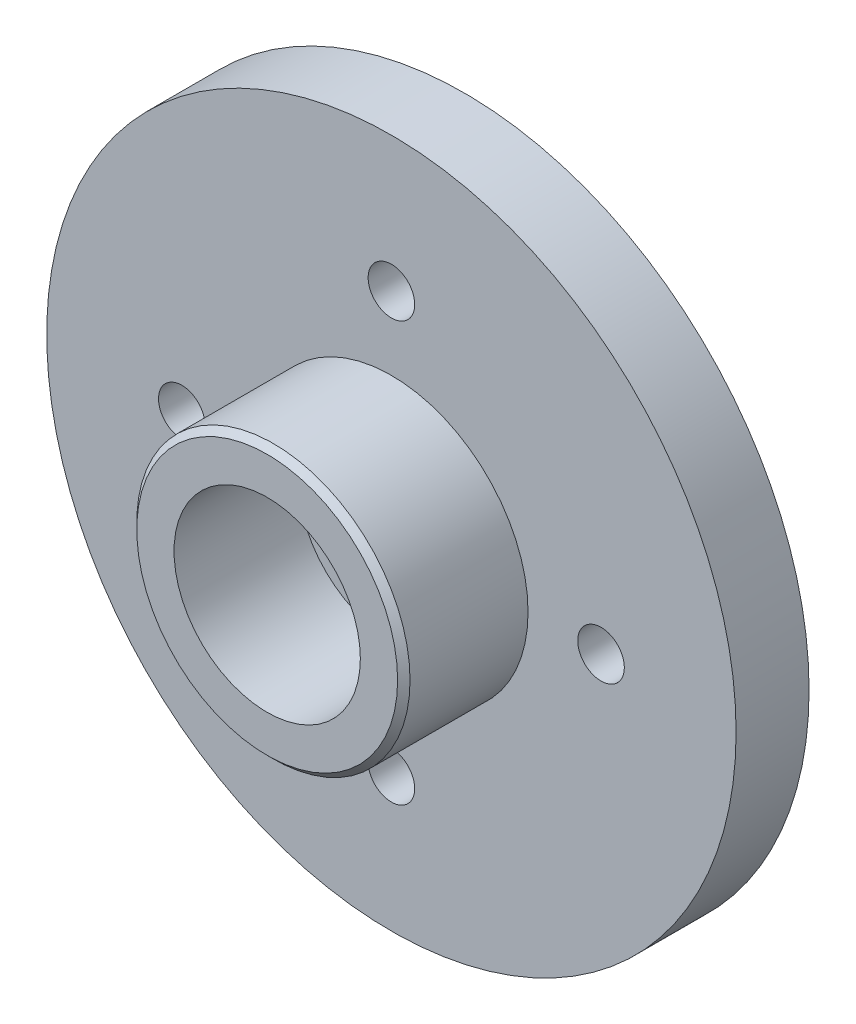
from build123d import *

# Parameters (mm, degrees)
ESQUISSE1_R             = 11.1
ESQUISSE1_R_2           = 1.5
BOSS_EXTRU_1_DEPTH      = 2.35
ESQUISSE2_R             = 4.4
ESQUISSE2_R_2           = 3
BOSS_EXTRU_2_DEPTH      = 4
ESQUISSE3_R             = 1.43
ENL_V_MAT_EXTRU_1_DEPTH = 4
CHANFREIN2_SIZE         = 0.2
ESQUISSE4_R             = 1.5
ENL_V_MAT_EXTRU_2_DEPTH = 4
BOSS_EXTRU_3_START      = -2.35
ESQUISSE5_R             = 1.5
ESQUISSE5_R_2           = 0.75
BOSS_EXTRU_3_DEPTH      = 2.35


with BuildPart() as part:
    # Esquisse1 → Boss.-Extru.1 (new body)
    with BuildSketch(Plane.XY):
        Circle(ESQUISSE1_R)
        with Locations((0, 6.75)):
            Circle(ESQUISSE1_R_2, mode=Mode.SUBTRACT)
        with Locations((0, -6.75)):
            Circle(ESQUISSE1_R_2, mode=Mode.SUBTRACT)
    extrude(amount=BOSS_EXTRU_1_DEPTH)

    # Esquisse2 → Boss.-Extru.2 (add)
    with BuildSketch(Plane.XY.offset(2.35)):
        Circle(ESQUISSE2_R)
        Circle(ESQUISSE2_R_2, mode=Mode.SUBTRACT)
    extrude(amount=BOSS_EXTRU_2_DEPTH)

    # Esquisse3 → Enlèv. mat.-Extru.1 (cut)
    with BuildSketch(Plane.XY.offset(2.35)):
        Circle(ESQUISSE3_R)
    extrude(amount=-ENL_V_MAT_EXTRU_1_DEPTH, mode=Mode.SUBTRACT)

    # Chanfrein2
    chanfrein2_edges = [part.edges().sort_by_distance(p)[0] for p in [
        (-4.4, 0, 6.35),
    ]]
    chamfer(chanfrein2_edges, length=CHANFREIN2_SIZE)

    # Esquisse4 → Enlèv. mat.-Extru.2 (cut)
    with BuildSketch(Plane(origin=(0, 0, 0), x_dir=(-1, 0, 0), z_dir=(0, 0, -1))):
        with Locations((-6.75, 0)):
            Circle(ESQUISSE4_R)
        with Locations((6.75, 0)):
            Circle(ESQUISSE4_R)
    extrude(amount=-ENL_V_MAT_EXTRU_2_DEPTH, mode=Mode.SUBTRACT)

    # Esquisse5 → Boss.-Extru.3 (add)
    # profile 1 of 4: a face of its own
    with BuildSketch(Plane.XY.offset(2.35).offset(BOSS_EXTRU_3_START)):
        with Locations((-6.75, 0)):
            Circle(ESQUISSE5_R)
        with Locations((-6.75, 0)):
            Circle(ESQUISSE5_R_2, mode=Mode.SUBTRACT)
    # profile 2 of 4: a face of its own
    with BuildSketch(Plane.XY.offset(2.35).offset(BOSS_EXTRU_3_START)):
        with Locations((0, -6.75)):
            Circle(ESQUISSE5_R)
        with Locations((0, -6.75)):
            Circle(ESQUISSE5_R_2, mode=Mode.SUBTRACT)
    # profile 3 of 4: a face of its own
    with BuildSketch(Plane.XY.offset(2.35).offset(BOSS_EXTRU_3_START)):
        with Locations((6.75, 0)):
            Circle(ESQUISSE5_R)
        with Locations((6.75, 0)):
            Circle(ESQUISSE5_R_2, mode=Mode.SUBTRACT)
    # profile 4 of 4: a face of its own
    with BuildSketch(Plane.XY.offset(2.35).offset(BOSS_EXTRU_3_START)):
        with Locations((0, 6.75)):
            Circle(ESQUISSE5_R)
        with Locations((0, 6.75)):
            Circle(ESQUISSE5_R_2, mode=Mode.SUBTRACT)
    extrude(amount=BOSS_EXTRU_3_DEPTH)


solid = part.part
